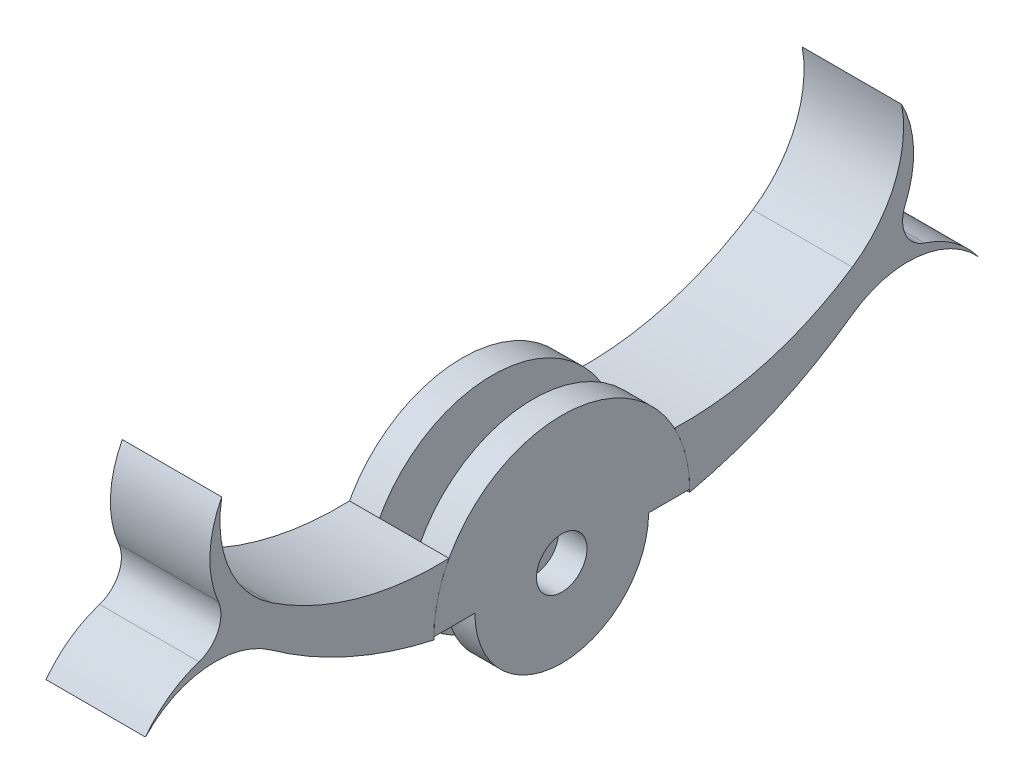
from build123d import *

# Parameters (mm, degrees)
SKETCH1_R           = 10.287
BOSS_EXTRUDE1_DEPTH = 8.001
SKETCH2_R           = 2.032
CUT_EXTRUDE1_DEPTH  = 3.7338
CUT_EXTRUDE2_START  = -3.7338
SKETCH3_R           = 2.032
CUT_EXTRUDE2_DEPTH  = 3.7338
BOSS_EXTRUDE2_DEPTH = 8.001
CUT_EXTRUDE3_START  = -8.001
CUT_EXTRUDE3_DEPTH  = 8.001
SKETCH6_W           = 3.302
SKETCH6_H           = 19.9136
CUT_EXTRUDE4_DEPTH  = 39.509209906


with BuildPart() as part:
    # Sketch1 → Boss-Extrude1 (new body)
    with BuildSketch(Plane(origin=(0, 0, 0), x_dir=(0, 0, -1), z_dir=(1, 0, 0))):
        Circle(SKETCH1_R)
    extrude(amount=BOSS_EXTRUDE1_DEPTH)

    # Sketch2 → Cut-Extrude1 (cut)
    with BuildSketch(Plane(origin=(8.001, 0, 0), x_dir=(0, 0, -1), z_dir=(1, 0, 0))):
        Circle(SKETCH2_R)
    extrude(amount=-CUT_EXTRUDE1_DEPTH, mode=Mode.SUBTRACT)

    # Sketch3 → Cut-Extrude2 (cut)
    with BuildSketch(Plane.ZY.offset(CUT_EXTRUDE2_START)):
        with Locations(Location((0, 0, 0), (0, 0, 180))):
            Circle(SKETCH3_R)
    extrude(amount=CUT_EXTRUDE2_DEPTH, mode=Mode.SUBTRACT)

    # Sketch5 → Cut-Extrude3 (cut)
    with BuildSketch(Plane(origin=(8.001, 0, 0), x_dir=(0, 0, -1), z_dir=(1, 0, 0)).offset(CUT_EXTRUDE3_START)):
        with BuildLine():
            Line((-6.985, 0), (-10.287, 0))
            ThreePointArc((-10.287, 0), (0, -10.287), (10.287, 0))
            Line((10.287, 0), (6.985, 0))
            ThreePointArc((6.985, 0), (0, -6.985), (-6.985, 0))
        make_face()
    extrude(amount=CUT_EXTRUDE3_DEPTH, mode=Mode.SUBTRACT)

    # Sketch6 → Cut-Extrude4 (cut, through all)
    with BuildSketch(Plane(origin=(0, 10.287, 0), x_dir=(1, 0, 0), z_dir=(0, 1, 0))):
        with Locations((4.064, 0)):
            Rectangle(SKETCH6_W, SKETCH6_H)
    extrude(amount=-CUT_EXTRUDE4_DEPTH, mode=Mode.SUBTRACT)


with BuildPart() as body_2:
    # Sketch4 → Boss-Extrude2 (new body)
    with BuildSketch(Plane.ZY):
        with BuildLine():
            ThreePointArc((9.066535783, 4.860071799), (10.003433712, 2.398683591), (10.284648783, -0.219928201))
            ThreePointArc((10.284648783, -0.219928201), (17.121583704, 2.037315344), (23.365648783, 5.622071799))
            ThreePointArc((23.365648783, 5.622071799), (28.610506662, 7.025976389), (33.475681659, 4.615674643))
            ThreePointArc((33.475681659, 4.615674643), (31.564768671, 6.496206487), (29.171267322, 7.704155061))
            ThreePointArc((29.171267322, 7.704155061), (27.638389928, 9.072717296), (27.619726913, 11.127547555))
            ThreePointArc((27.619726913, 11.127547555), (28.291483716, 14.73214833), (27.341838119, 18.273698442))
            ThreePointArc((27.341838119, 18.273698442), (26.750112425, 13.005040292), (23.365648783, 8.924071799))
            ThreePointArc((23.365648783, 8.924071799), (16.53490074, 5.770349813), (9.066535783, 4.860071799))
        make_face()
    extrude(amount=-BOSS_EXTRUDE2_DEPTH)


with BuildPart() as body_3:
    # Mirror3: mirrored copy
    add(body_2.part.mirror(Plane.XY))


solid = Compound([part.part, body_2.part, body_3.part])
